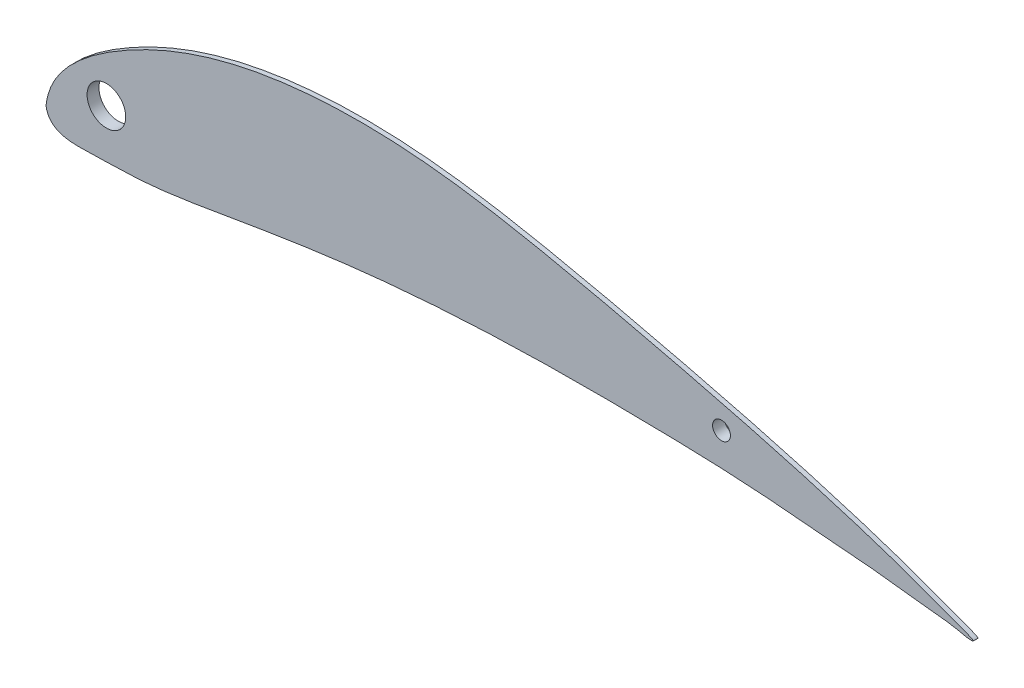
from build123d import *

# Parameters (mm, degrees)
BOSS_EXTRUDE1_DEPTH = 1.5875
SKETCH2_R           = 8
SKETCH2_R_2         = 6.5
SKETCH2_R_3         = 4.5
SKETCH2_R_4         = 3
BOSS_EXTRUDE2_DEPTH = 4
SKETCH2_4_R         = 6.5
SKETCH2_4_R_2       = 3
CUT_EXTRUDE1_DEPTH  = 4


with BuildPart() as part:
    # Sketch1 → Boss-Extrude1 (new body)
    with BuildSketch(Plane.XY):
        with BuildLine():
            add(Edge.make_bspline(
                [(0.000560351, 0.000130087), (0.810633127, 7.359196055), (8.649092025, 17.856605174), (26.286719818, 29.975176328), (52.111128271, 42.069215275), (89.597618475, 49.290763054), (131.400792109, 47.884831915), (173.256699242, 40.041104278), (217.961060472, 29.612974894), (256.952064401, 19.528920948), (290.35983767, 8.71099439), (301.273197721, 4.382828139), (314.816918223, -0.516206742), (309.846313895, 0.000130087)],
                knots=[0, 0, 0, 0, 0.060863618, 0.113688265, 0.188608742, 0.312908923, 0.448482434, 0.557612135, 0.691544113, 0.852438279, 0.92975597, 0.976058229, 1, 1, 1, 1], degree=3))
            add(Edge.make_bspline(
                [(309.846313895, 0.000130087), (303.956832565, 1.47095521), (293.989507544, 2.093987313), (276.26402299, 4.514356704), (260.846344817, 5.427413394), (235.858814759, 7.870306192), (205.101424636, 8.838080282), (157.718638092, 9.030650149), (110.497331172, 6.181495223), (66.506197185, -0.586669107), (36.454672816, -6.098499901), (15.316603331, -6.189065841), (1.230714189, -6.924076091), (0.000560351, 0.000130087)],
                knots=[0, 0, 0, 0, 0.057787081, 0.095274891, 0.171021118, 0.205339302, 0.335319146, 0.464904334, 0.658702312, 0.785511947, 0.893517288, 0.94309214, 1, 1, 1, 1], degree=3))
        make_face()
    extrude(amount=BOSS_EXTRUDE1_DEPTH)

    # Sketch2 → Boss-Extrude2 (add)
    # profile 1 of 2: a face of its own
    with BuildSketch(Plane.XY.offset(1.5875)):
        with Locations((20.32, 10.16)):
            Circle(SKETCH2_R)
        with Locations((20.32, 10.16)):
            Circle(SKETCH2_R_2, mode=Mode.SUBTRACT)
    # profile 2 of 2: a face of its own
    with BuildSketch(Plane.XY.offset(1.5875)):
        with Locations((227.296313895, 19.050130087)):
            Circle(SKETCH2_R_3)
        with Locations((227.296313895, 19.050130087)):
            Circle(SKETCH2_R_4, mode=Mode.SUBTRACT)
    extrude(amount=-BOSS_EXTRUDE2_DEPTH)

    # Sketch2<4> → Cut-Extrude1 (cut)
    with BuildSketch(Plane.XY.offset(1.5875)):
        with Locations((20.32, 10.16)):
            Circle(SKETCH2_4_R)
        with Locations((227.296313895, 19.050130087)):
            Circle(SKETCH2_4_R_2)
    extrude(amount=-CUT_EXTRUDE1_DEPTH, mode=Mode.SUBTRACT)


solid = part.part
